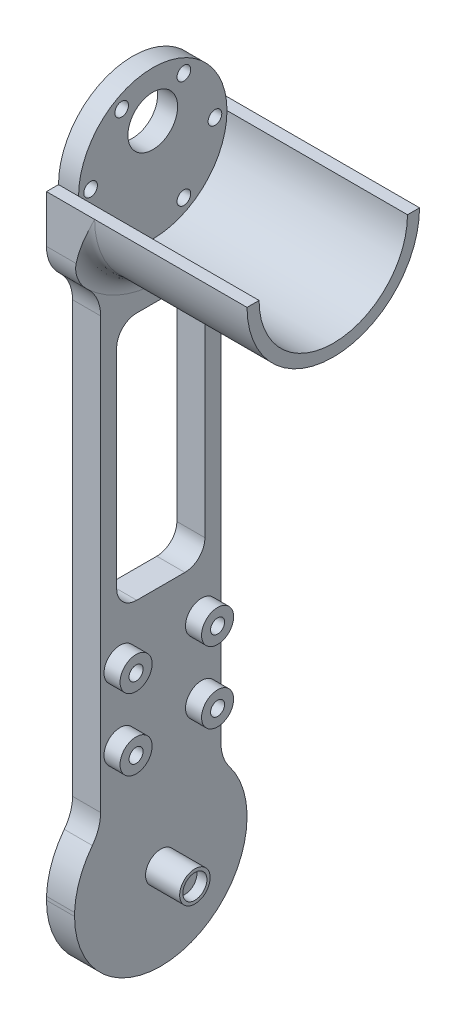
from build123d import *

# Parameters (mm, degrees)
SKETCH1_R                = 18.5
BOSS_EXTRUDE1_DEPTH      = 5
SKETCH2_R                = 6.2
CUT_EXTRUDE1_DEPTH       = 10
SKETCH3_R                = 1.6999999999999995
SKETCH3_R_2              = 1.6999999999998752
SKETCH3_R_3              = 1.7000000000002367
SKETCH3_R_4              = 1.700000000000381
SKETCH3_R_5              = 1.7000000000003195
SKETCH3_R_6              = 1.7000000000003193
CUT_EXTRUDE2_DEPTH       = 10
BOSS_EXTRUDE2_DEPTH      = 50
BOSS_EXTRUDE3_DEPTH      = 7
CUT_EXTRUDE3_DEPTH       = 20
BOSS_EXTRUDE4_DEPTH      = 8.5
BOSS_EXTRUDE4_DEPTH_BACK = 15.499999999999996
SKETCH7_R                = 3.799999999999999
SKETCH8_R                = 4.000000000000005
SKETCH8_R_2              = 1.7500000000000004
SKETCH8_R_3              = 4.000000000000007
BOSS_EXTRUDE5_DEPTH      = 4
CUT_EXTRUDE4_START       = -2
SKETCH8_2_R              = 1.7500000000000004
CUT_EXTRUDE4_DEPTH       = 2
FILLET1_R                = 5
SKETCH9_R                = 3.0000000000000036
CUT_EXTRUDE5_DEPTH       = 2.5
CUT_EXTRUDE6_DEPTH       = 182.00138122207798
FILLET2_R                = 10
SKETCH11_W               = 22.00000000000001
SKETCH11_H               = 61.99999999999998
CUT_EXTRUDE7_DEPTH       = 182.00138122207798
FILLET3_R                = 5


with BuildPart() as part:
    # Sketch1 → Boss-Extrude1 (new body)
    with BuildSketch(Plane(origin=(0, 0, 0), x_dir=(0, 0, -1), z_dir=(1, 0, 0))):
        Circle(SKETCH1_R)
    extrude(amount=BOSS_EXTRUDE1_DEPTH)

    # Sketch2 → Cut-Extrude1 (cut)
    with BuildSketch(Plane(origin=(5, 0, 0), x_dir=(0, 0, -1), z_dir=(1, 0, 0))):
        with Locations((0, 7)):
            Circle(SKETCH2_R)
    extrude(amount=-CUT_EXTRUDE1_DEPTH, mode=Mode.SUBTRACT)

    # Sketch3 → Cut-Extrude2 (cut)
    with BuildSketch(Plane(origin=(0, 0, 0), x_dir=(0, 0, -1), z_dir=(1, 0, 0))):
        with Locations((15.5, 0)):
            Circle(SKETCH3_R)
        with Locations((7.750000000000335, -13.423393758658609)):
            Circle(SKETCH3_R_2)
        with Locations((-7.749999999999674, -13.423393758658612)):
            Circle(SKETCH3_R_3)
        with Locations((-15.499999999999568, 0)):
            Circle(SKETCH3_R_4)
        with Locations((-7.749999999999682, 13.42339375865861)):
            Circle(SKETCH3_R_5)
        with Locations((7.749999999999989, 13.42339375865842)):
            Circle(SKETCH3_R_6)
    extrude(amount=CUT_EXTRUDE2_DEPTH, mode=Mode.SUBTRACT)

    # Sketch4 → Boss-Extrude2 (add)
    with BuildSketch(Plane.ZY):
        with BuildLine():
            Line((-18.5, 0), (-21.5, 0))
            ThreePointArc((-21.5, 0), (-3.95e-15, -21.5), (21.5, 0))
            Line((21.5, 0), (18.5, 0))
            ThreePointArc((18.5, 0), (-3.4e-15, -18.5), (-18.5, 0))
        make_face()
    extrude(amount=-BOSS_EXTRUDE2_DEPTH)

    # Sketch5 → Boss-Extrude3 (add)
    with BuildSketch(Plane.ZY):
        with BuildLine():
            Line((-21.5, 0), (-18.5, 0))
            ThreePointArc((-18.5, 0), (-3.4e-15, -18.5), (18.5, 0))
            Line((18.5, 0), (21.5, 0))
            Line((21.5, 0), (21.500000000000018, -174.5))
            Line((21.500000000000018, -174.5), (-21.49999999999998, -174.5))
            Line((-21.49999999999998, -174.5), (-21.5, 0))
        make_face()
    extrude(amount=-BOSS_EXTRUDE3_DEPTH)

    # Sketch6 → Cut-Extrude3 (cut)
    with BuildSketch(Plane(origin=(7, 0, 0), x_dir=(0, 0, -1), z_dir=(1, 0, 0))):
        with BuildLine():
            Line((21.49999999999998, -174.5), (21.499999999999982, -153.00000000000003))
            ThreePointArc((21.5, -153.00000000000003), (15.20279579551168, -168.20279579550987), (2.57571e-12, -174.5))
            Line((2.57572e-12, -174.5), (21.499999999999982, -174.5))
        make_face()
        with BuildLine():
            ThreePointArc((2.57571e-12, -174.5), (-15.202795795509834, -168.2027957955117), (-21.499999999999957, -153.00000000000003))
            Line((-21.500000000000014, -153.00000000000003), (-21.500000000000018, -174.5))
            Line((-21.500000000000018, -174.5), (2.57572e-12, -174.5))
        make_face()
    extrude(amount=-CUT_EXTRUDE3_DEPTH, mode=Mode.SUBTRACT)

    # Sketch7 → Boss-Extrude4 (add, two sides: drawn at the far end of the back side and taken through both)
    with BuildSketch(Plane(origin=(7, 0, 0), x_dir=(0, 0, -1), z_dir=(1, 0, 0)).offset(-BOSS_EXTRUDE4_DEPTH_BACK)):
        with Locations((2.082e-14, -153.00000000000003)):
            Circle(SKETCH7_R)
    extrude(amount=BOSS_EXTRUDE4_DEPTH + BOSS_EXTRUDE4_DEPTH_BACK)

    # Sketch8 → Boss-Extrude5 (add)
    # profile 1 of 4: a face of its own
    with BuildSketch(Plane(origin=(7, 0, 0), x_dir=(0, 0, -1), z_dir=(1, 0, 0))):
        with Locations((10.160000000000018, -121.88999999999999)):
            Circle(SKETCH8_R)
        with Locations((10.160000000000018, -121.88999999999999)):
            Circle(SKETCH8_R_2, mode=Mode.SUBTRACT)
    # profile 2 of 4: a face of its own
    with BuildSketch(Plane(origin=(7, 0, 0), x_dir=(0, 0, -1), z_dir=(1, 0, 0))):
        with Locations((-10.159999999999984, -121.88999999999999)):
            Circle(SKETCH8_R_3)
        with Locations((-10.159999999999984, -121.88999999999999)):
            Circle(SKETCH8_R_2, mode=Mode.SUBTRACT)
    # profile 3 of 4: a face of its own
    with BuildSketch(Plane(origin=(7, 0, 0), x_dir=(0, 0, -1), z_dir=(1, 0, 0))):
        with Locations((-10.159999999999984, -104.10999999999999)):
            Circle(SKETCH8_R_3)
        with Locations((-10.159999999999984, -104.10999999999999)):
            Circle(SKETCH8_R_2, mode=Mode.SUBTRACT)
    # profile 4 of 4: a face of its own
    with BuildSketch(Plane(origin=(7, 0, 0), x_dir=(0, 0, -1), z_dir=(1, 0, 0))):
        with Locations((10.160000000000018, -104.10999999999999)):
            Circle(SKETCH8_R)
        with Locations((10.160000000000018, -104.10999999999999)):
            Circle(SKETCH8_R_2, mode=Mode.SUBTRACT)
    extrude(amount=BOSS_EXTRUDE5_DEPTH)

    # Sketch8<2> → Cut-Extrude4 (cut)
    with BuildSketch(Plane(origin=(7, 0, 0), x_dir=(0, 0, -1), z_dir=(1, 0, 0)).offset(CUT_EXTRUDE4_START)):
        with Locations((-10.159999999999984, -104.10999999999999)):
            Circle(SKETCH8_2_R)
        with Locations((10.160000000000018, -104.10999999999999)):
            Circle(SKETCH8_2_R)
        with Locations((-10.159999999999984, -121.88999999999999)):
            Circle(SKETCH8_2_R)
        with Locations((10.160000000000018, -121.88999999999999)):
            Circle(SKETCH8_2_R)
    extrude(amount=CUT_EXTRUDE4_DEPTH, mode=Mode.SUBTRACT)

    # Fillet1
    fillet1_edges = [part.edges().sort_by_distance(p)[0] for p in [
        (7, -21.5, -2.2e-15),
    ]]
    fillet(fillet1_edges, radius=FILLET1_R)

    # Sketch9 → Cut-Extrude5 (cut)
    with BuildSketch(Plane(origin=(15.5, 0, 0), x_dir=(0, 0, -1), z_dir=(1, 0, 0))):
        with Locations((2.082e-14, -153.00000000000003)):
            Circle(SKETCH9_R)
    extrude(amount=-CUT_EXTRUDE5_DEPTH, mode=Mode.SUBTRACT)

    # Sketch10 → Cut-Extrude6 (cut, through all)
    with BuildSketch(Plane(origin=(7, 0, 0), x_dir=(0, 0, -1), z_dir=(1, 0, 0))):
        with BuildLine():
            Line((-15.000000000000016, -137.57296518391348), (-15.000000000000014, -21.84605227495347))
            ThreePointArc((-15.000000000000018, -21.84605227495347), (-18.524475882395627, -18.94977026991469), (-21.5, -15.491933384829668))
            Line((-21.5, -15.491933384829668), (-21.5, -152.13779166279446))
            ThreePointArc((-21.500000000000007, -152.13779166279446), (-19.64932677192729, -144.23088598393383), (-15.000000000000014, -137.57296518391348))
        make_face()
        with BuildLine():
            ThreePointArc((21.499999999999996, -15.491933384829675), (18.52447588239562, -18.949770269914705), (14.999999999999996, -21.846052274953482))
            Line((14.999999999999996, -21.846052274953482), (14.999999999999995, -137.57296518391342))
            ThreePointArc((14.999999999999995, -137.57296518391342), (19.649326771927107, -144.23088598393335), (21.499999999999993, -152.1377916627935))
            Line((21.499999999999996, -152.1377916627935), (21.499999999999996, -15.491933384829672))
        make_face()
    extrude(amount=-CUT_EXTRUDE6_DEPTH, mode=Mode.SUBTRACT)

    # Fillet2
    fillet2_edges = [part.edges().sort_by_distance(p)[0] for p in [
        (3.5, -137.57296518391348, 15.000000000000014),
        (3.5, -137.57296518391342, -14.999999999999991),
        (3.5, -21.846052274953486, -14.999999999999998),
        (3.5, -15.491933384829675, -21.5),
        (3.5, -21.846052274953465, 15.000000000000014),
        (3.5, -15.491933384829668, 21.5),
    ]]
    fillet(fillet2_edges, radius=FILLET2_R)

    # Sketch11 → Cut-Extrude7 (cut, through all)
    with BuildSketch(Plane(origin=(7, 0, 0), x_dir=(0, 0, -1), z_dir=(1, 0, 0))):
        with Locations((-8.88e-15, -61.47322598734716)):
            Rectangle(SKETCH11_W, SKETCH11_H)
    extrude(amount=-CUT_EXTRUDE7_DEPTH, mode=Mode.SUBTRACT)

    # Fillet3
    fillet3_edges = [part.edges().sort_by_distance(p)[0] for p in [
        (3.5, -30.47322598734717, 11.000000000000014),
        (3.5, -30.47322598734717, -10.999999999999996),
        (3.5, -92.47322598734716, -10.999999999999996),
        (3.5, -92.47322598734716, 11.000000000000014),
    ]]
    fillet(fillet3_edges, radius=FILLET3_R)


solid = part.part
